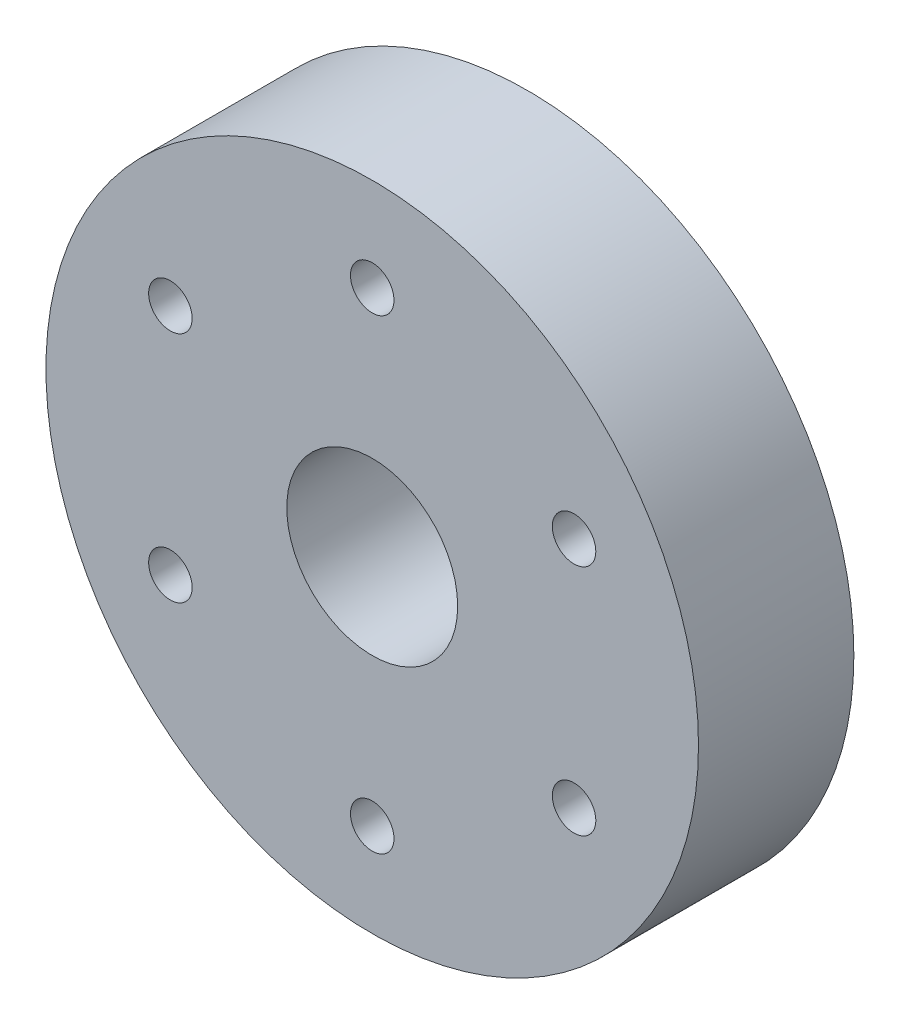
from build123d import *

# Parameters (mm, degrees)
SKETCH_1_R               = 21
EXTRUDE_1_DEPTH          = 10
SKETCH_2_R               = 1.4
CUT_EXTRUDE_1_DEPTH      = 32.336879232
PATTERN_CIRCULAR_1_COUNT = 6
SKETCH_3_R               = 5.5
CUT_EXTRUDE_2_DEPTH      = 32.336879232


with BuildPart() as part:
    # 草图1 → 凸台-拉伸1 (new body)
    with BuildSketch(Plane.XY):
        Circle(SKETCH_1_R)
    extrude(amount=EXTRUDE_1_DEPTH)

    # 草图2 → 切除-拉伸1 (cut, through all)
    with BuildSketch(Plane.XY.offset(10)):
        with Locations((12.990381057, 7.5)):
            Circle(SKETCH_2_R)
    cut_extrude_1 = extrude(amount=-CUT_EXTRUDE_1_DEPTH, mode=Mode.SUBTRACT)

    # 阵列(圆周)1: 切除-拉伸1 ×6 about axis
    pattern_circular_1_axis = Axis((0, 0, 0), (0, 0, 1))
    for i in range(1, PATTERN_CIRCULAR_1_COUNT):
        add(cut_extrude_1.rotate(pattern_circular_1_axis, i * 360 / PATTERN_CIRCULAR_1_COUNT), mode=Mode.SUBTRACT)

    # 草图3 → 切除-拉伸2 (cut, through all)
    with BuildSketch(Plane.XY.offset(10)):
        Circle(SKETCH_3_R)
    extrude(amount=-CUT_EXTRUDE_2_DEPTH, mode=Mode.SUBTRACT)


solid = part.part
